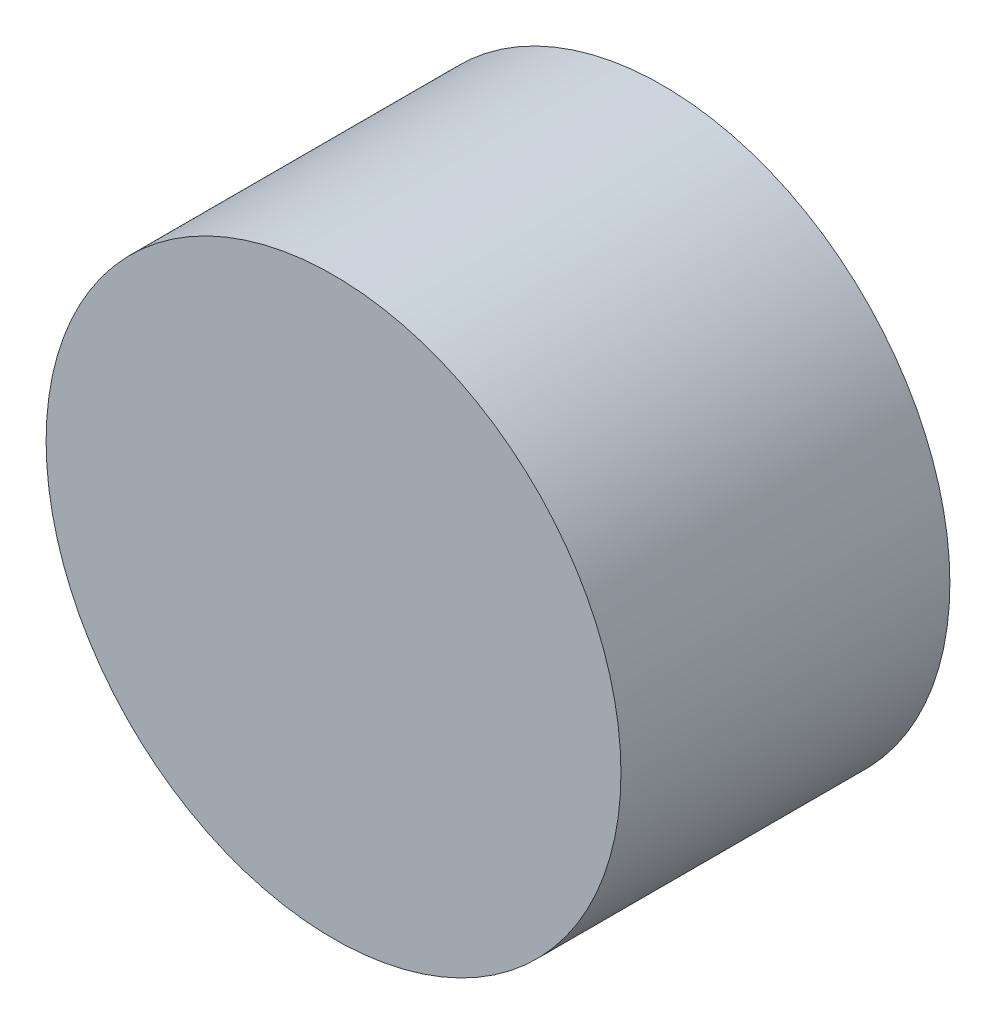
from build123d import *

# Parameters (mm, degrees)
SKETCH1_R           = 26.65
BOSS_EXTRUDE2_DEPTH = 30.5


with BuildPart() as part:
    # Sketch1 → Boss-Extrude2 (new body)
    with BuildSketch(Plane.XY):
        with Locations(Location((0, 0, 0), (0, 0, 180))):
            Circle(SKETCH1_R)
    extrude(amount=BOSS_EXTRUDE2_DEPTH)


solid = part.part
